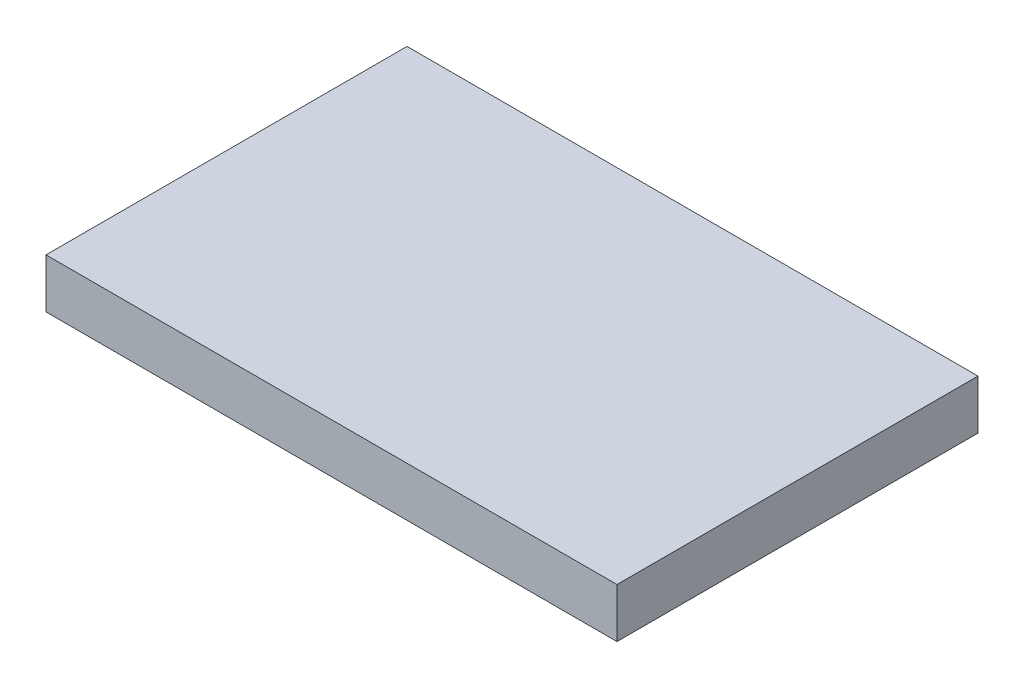
from build123d import *

# Parameters (mm, degrees)
SKETCH1_W           = 115.519711691
SKETCH1_H           = 73.040982756
BOSS_EXTRUDE2_DEPTH = 10


with BuildPart() as part:
    # Sketch1 → Boss-Extrude2 (new body)
    with BuildSketch(Plane(origin=(0, 0, 0), x_dir=(1, 0, 0), z_dir=(0, 1, 0))):
        with Locations((57.759855846, 36.520491378)):
            Rectangle(SKETCH1_W, SKETCH1_H)
    extrude(amount=BOSS_EXTRUDE2_DEPTH)


solid = part.part
